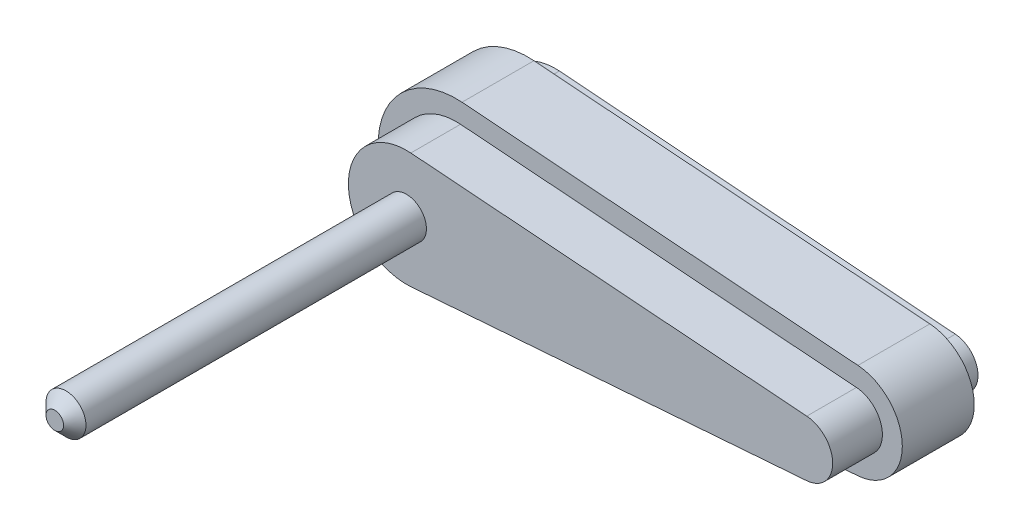
from build123d import *

# Parameters (mm, degrees)
BOSS_EXTRUDE1_DEPTH = 23.6474
CUT_EXTRUDE1_START  = -15.748
CUT_EXTRUDE1_DEPTH  = 15.748
SKETCH3_R           = 3.175
BOSS_EXTRUDE2_DEPTH = 55.88
BOSS_EXTRUDE3_DEPTH = 11.43
CHAMFER1_SIZE       = 1.778


with BuildPart() as part:
    # Sketch1 → Boss-Extrude1 (new body)
    with BuildSketch(Plane.XY):
        with BuildLine():
            Line((0.695350686, 9.200310447), (63.61372159, 4.445))
            ThreePointArc((63.61372159, 4.445), (67.73545, 0), (63.61372159, -4.445))
            Line((63.61372159, -4.445), (0.695350686, -9.200310447))
            ThreePointArc((0.695350686, -9.200310447), (-9.22655, 0), (0.695350686, 9.200310447))
        make_face()
    extrude(amount=-BOSS_EXTRUDE1_DEPTH)

    # Sketch2 → Cut-Extrude1 (cut)
    with BuildSketch(Plane(origin=(0, 0, -23.6474), x_dir=(-1, 0, 0), z_dir=(0, 0, -1)).offset(CUT_EXTRUDE1_START)):
        with BuildLine():
            Line((-0.695350686, 9.200310447), (-63.61372159, 4.445))
            ThreePointArc((-63.61372159, 4.445), (-67.73545, 0), (-63.61372159, -4.445))
            Line((-63.61372159, -4.445), (-0.695350686, -9.200310447))
            ThreePointArc((-0.695350686, -9.200310447), (9.22655, 0), (-0.695350686, 9.200310447))
        make_face()
        with BuildLine():
            Line((-0.653237224, 8.643099629), (-63.571608128, 3.887789181))
            ThreePointArc((-63.571608128, 3.887789181), (-67.17665, 0), (-63.571608128, -3.887789181))
            Line((-63.571608128, -3.887789181), (-0.653237224, -8.643099629))
            ThreePointArc((-0.653237224, -8.643099629), (8.66775, 0), (-0.653237224, 8.643099629))
        make_face(mode=Mode.SUBTRACT)
    extrude(amount=CUT_EXTRUDE1_DEPTH, mode=Mode.SUBTRACT)

    # Sketch3 → Boss-Extrude2 (add)
    with BuildSketch(Plane.XY):
        Circle(SKETCH3_R)
    extrude(amount=BOSS_EXTRUDE2_DEPTH)

    # Sketch4 → Boss-Extrude3 (add)
    with BuildSketch(Plane(origin=(0, 0, -7.8994), x_dir=(-1, 0, 0), z_dir=(0, 0, -1))):
        with BuildLine():
            Line((-0.933674597, 12.353617125), (-63.852045501, 7.598306678))
            ThreePointArc((-63.852045501, 7.598306678), (-70.89775, 0), (-63.852045501, -7.598306678))
            Line((-63.852045501, -7.598306678), (-0.933674597, -12.353617125))
            ThreePointArc((-0.933674597, -12.353617125), (12.38885, 0), (-0.933674597, 12.353617125))
        make_face()
        with BuildLine():
            Line((-0.653237224, 8.643099629), (-63.571608128, 3.887789181))
            ThreePointArc((-63.571608128, 3.887789181), (-67.17665, 0), (-63.571608128, -3.887789181))
            Line((-63.571608128, -3.887789181), (-0.653237224, -8.643099629))
            ThreePointArc((-0.653237224, -8.643099629), (8.66775, 0), (-0.653237224, 8.643099629))
        make_face(mode=Mode.SUBTRACT)
    extrude(amount=BOSS_EXTRUDE3_DEPTH)

    # Chamfer1
    chamfer1_edges = [part.edges().sort_by_distance(p)[0] for p in [
        (-3.175, 0, 55.88),
    ]]
    chamfer(chamfer1_edges, length=CHAMFER1_SIZE)


solid = part.part
